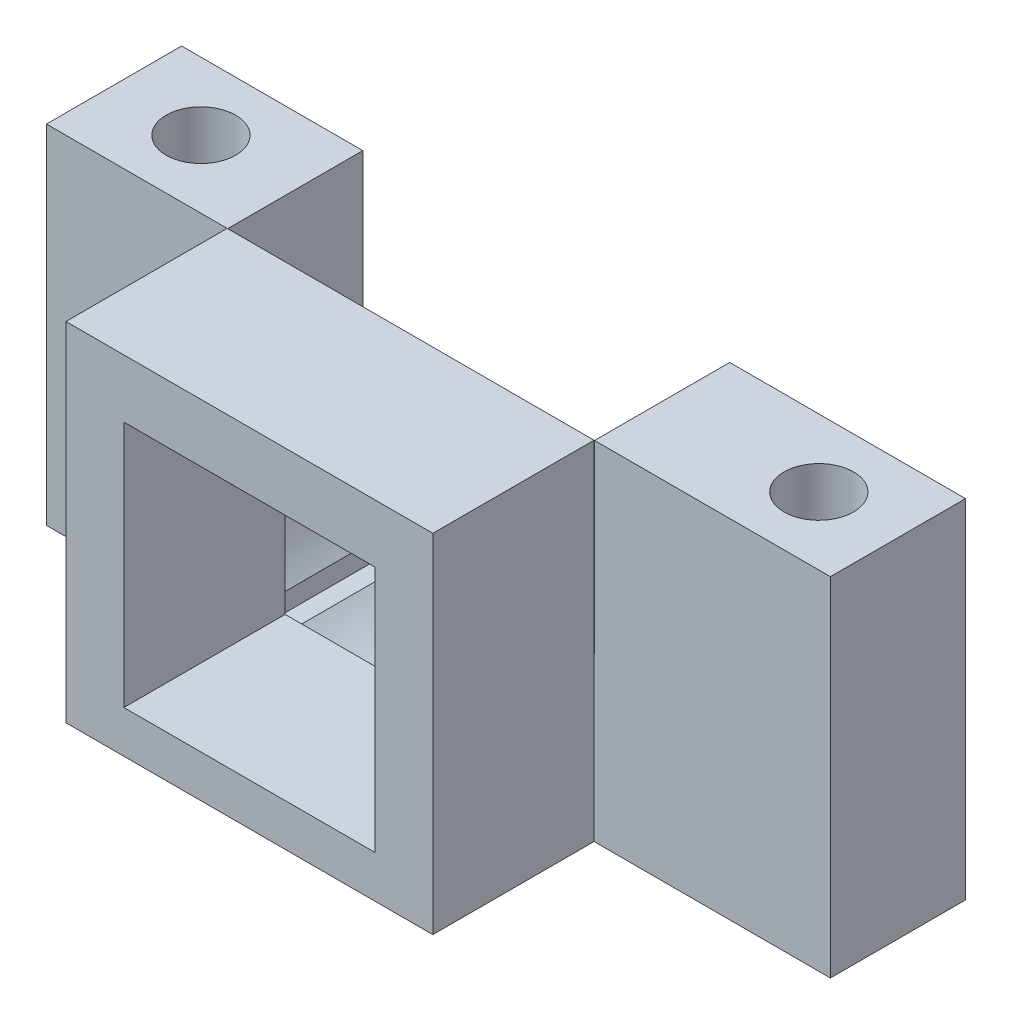
from build123d import *

# Parameters (mm, degrees)
BOSS_EXTRUDE1_DEPTH   = 7
BOSS_EXTRUDE1_2_DEPTH = 7
SKETCH2_W             = 19.000397442
SKETCH2_H             = 18
SKETCH2_W_2           = 13
SKETCH2_H_2           = 12.8
BOSS_EXTRUDE2_DEPTH   = 8.35
SKETCH3_R             = 1.8
CUT_EXTRUDE1_DEPTH    = 47.557840371


with BuildPart() as part:
    # Sketch1 → Boss-Extrude1 (new body)
    with BuildSketch(Plane.XY):
        with BuildLine():
            Line((-0.5, 19.7), (-0.5, 1.7))
            Line((-0.5, 1.7), (17.158948763, 1.7))
            ThreePointArc((17.158948763, 1.7), (14.736483801, 2.411824757), (12.618126572, 3.785721996))
            Line((12.618126572, 3.785721996), (11.684321255, 3.785721996))
            Line((11.684321255, 3.785721996), (11.684321255, 4.740579311))
            ThreePointArc((11.684321255, 4.740579311), (10.208452966, 7.257442509), (9.642129796, 10.119620985))
            Line((9.642129796, 10.119620985), (8.884321255, 10.119620985))
            Line((8.884321255, 10.119620985), (8.884321255, 19.7))
            Line((8.884321255, 19.7), (-0.5, 19.7))
        make_face()
    extrude(amount=BOSS_EXTRUDE1_DEPTH)



with BuildPart() as body_2:
    # Sketch1 → Boss-Extrude1 2 (new body)
    with BuildSketch(Plane.XY):
        with BuildLine():
            ThreePointArc((24.159354013, 3.785721996), (22.040996783, 2.411824757), (19.618531821, 1.7))
            Line((19.618531821, 1.7), (40.1, 1.7))
            Line((40.1, 1.7), (40.1, 19.7))
            Line((40.1, 19.7), (27.884321255, 19.7))
            Line((27.884321255, 19.7), (27.884321255, 10.119620985))
            Line((27.884321255, 10.119620985), (27.135350788, 10.119620985))
            ThreePointArc((27.135350788, 10.119620985), (26.566586462, 7.25102021), (25.084321255, 4.730057473))
            Line((25.084321255, 4.730057473), (25.084321255, 3.785721996))
            Line((25.084321255, 3.785721996), (24.159354013, 3.785721996))
        make_face()
    extrude(amount=BOSS_EXTRUDE1_2_DEPTH)


with BuildPart() as part_1:
    add(part.part)

    add(body_2.part)  # Boss-Extrude2 merges body 2
    # Sketch2 → Boss-Extrude2 (add)
    with BuildSketch(Plane.XY.offset(7)):
        with Locations((18.360198721, 10.7)):
            Rectangle(SKETCH2_W, SKETCH2_H)
        with Locations((18.360397442, 10.287463183)):
            Rectangle(SKETCH2_W_2, SKETCH2_H_2, mode=Mode.SUBTRACT)
    extrude(amount=BOSS_EXTRUDE2_DEPTH)

    # Sketch3 → Cut-Extrude1 (cut, through all)
    with BuildSketch(Plane(origin=(0, 19.7, 0), x_dir=(1, 0, 0), z_dir=(0, 1, 0))):
        with Locations(Location((4, -3.5, 0), (0, 0, 270))):
            Circle(SKETCH3_R)
        with Locations(Location((36, -3.5, 0), (0, 0, 270))):
            Circle(SKETCH3_R)
    extrude(amount=-CUT_EXTRUDE1_DEPTH, mode=Mode.SUBTRACT)


solid = part_1.part
